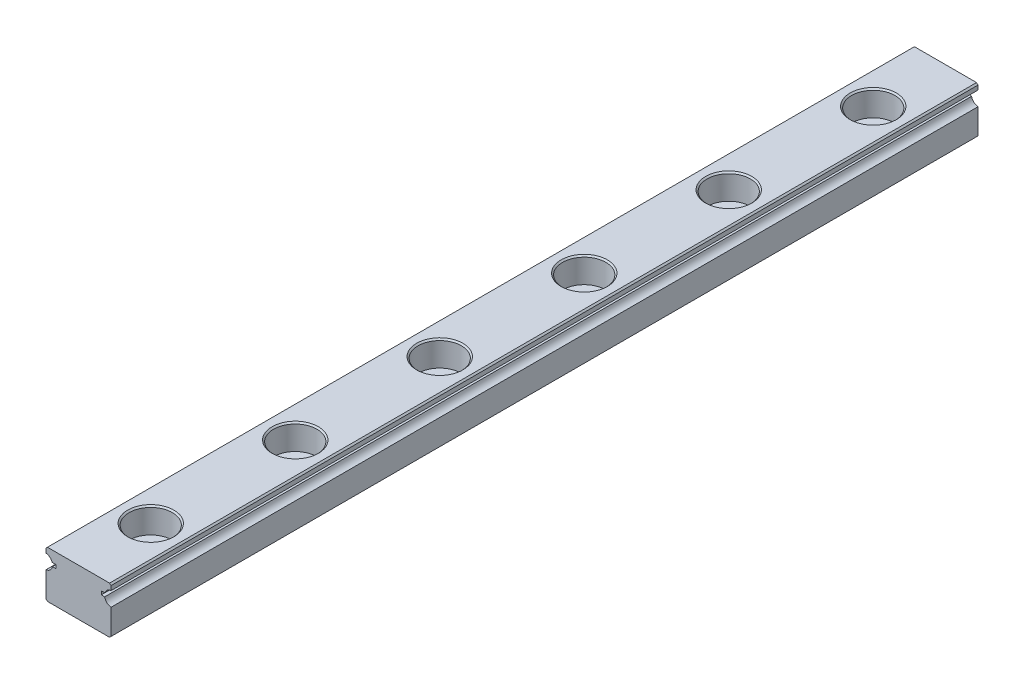
from build123d import *

# Parameters (mm, degrees)
EXTRUDE1_DEPTH             = 120
EXTRUDE2_REACH             = 122.26
SKETCH2_R                  = 1.75
SKETCH_R                   = 3
SKETCH_R_2                 = 1.75
EXTRUDE4_DEPTH             = 3.5
CHAMFER1_SIZE              = 0.2
LPATTERN1_COUNT            = 6
LPATTERN1_PITCH            = 20
CHAMFER1_OF_LPATTERN1_SIZE = 0.2


with BuildPart() as part:
    # Sketch1 → Extrude1 (new body)
    with BuildSketch(Plane.XY):
        with BuildLine():
            Line((-4.3, -3.25), (4.3, -3.25))
            Line((4.3, -3.25), (4.5, -3.05))
            Line((4.5, -3.05), (4.5, 0.455012563))
            ThreePointArc((4.5, 0.455012563), (3.924845827, 0.712323349), (3.617735397, 1.2625))
            Line((3.617735397, 1.2625), (3.15008224, 1.2625))
            Line((3.15008224, 1.2625), (3.15008224, 1.7625))
            Line((3.15008224, 1.7625), (3.65008224, 1.7625))
            ThreePointArc((3.65008224, 1.7625), (3.973877727, 2.229724887), (4.5, 2.444987437))
            Line((4.5, 2.444987437), (4.5, 3.05))
            Line((4.5, 3.05), (4.3, 3.25))
            Line((4.3, 3.25), (-4.3, 3.25))
            Line((-4.3, 3.25), (-4.5, 3.05))
            Line((-4.5, 3.05), (-4.5, 2.444987437))
            ThreePointArc((-4.5, 2.444987437), (-3.973877727, 2.229724887), (-3.65008224, 1.7625))
            Line((-3.65008224, 1.7625), (-3.15008224, 1.7625))
            Line((-3.15008224, 1.7625), (-3.15008224, 1.2625))
            Line((-3.15008224, 1.2625), (-3.617735397, 1.2625))
            ThreePointArc((-3.617735397, 1.2625), (-3.924845827, 0.712323349), (-4.5, 0.455012563))
            Line((-4.5, 0.455012563), (-4.5, -3.05))
            Line((-4.5, -3.05), (-4.3, -3.25))
        make_face()
    extrude(amount=EXTRUDE1_DEPTH)

    # Sketch2 → Extrude2 (cut, up to next)
    with BuildSketch(Plane(origin=(0, 3.25, 0), x_dir=(1, 0, 0), z_dir=(0, 1, 0)), mode=Mode.PRIVATE) as extrude2_sk1:
        with Locations((0, -10)):
            Circle(SKETCH2_R)
    extrude2_tool1 = extrude(extrude2_sk1.sketch, amount=-EXTRUDE2_REACH, mode=Mode.PRIVATE) & part.part
    extrude2 = extrude2_tool1.solids().sort_by_distance((0, 3.25, 10))[0]
    add(extrude2, mode=Mode.SUBTRACT)

    # Sketch → Extrude4 (cut)
    with BuildSketch(Plane(origin=(0, 3.25, 0), x_dir=(1, 0, 0), z_dir=(0, 1, 0))):
        with Locations((0, -10)):
            Circle(SKETCH_R)
        with Locations((0, -10)):
            Circle(SKETCH_R_2, mode=Mode.SUBTRACT)
    extrude4 = extrude(amount=-EXTRUDE4_DEPTH, mode=Mode.SUBTRACT)

    # Chamfer1
    chamfer1_edges = [part.edges().sort_by_distance(p)[0] for p in [
        (-1.75, -3.25, 10),
        (-3, 3.25, 10),
    ]]
    chamfer(chamfer1_edges, length=CHAMFER1_SIZE)

    # LPattern1: Extrude2, Extrude4 ×6
    with Locations(*[(0, 0, i * LPATTERN1_PITCH) for i in range(1, LPATTERN1_COUNT)]):
        add(extrude2, mode=Mode.SUBTRACT)
        add(extrude4, mode=Mode.SUBTRACT)

    # Chamfer1 of LPattern1
    chamfer1_of_lpattern1_edges = [part.edges().sort_by_distance(p)[0] for p in [
        (-1.75, -3.25, 30),
        (-3, 3.25, 30),
        (-1.75, -3.25, 50),
        (-3, 3.25, 50),
        (-1.75, -3.25, 70),
        (-3, 3.25, 70),
        (-1.75, -3.25, 90),
        (-3, 3.25, 90),
        (-1.75, -3.25, 110),
        (-3, 3.25, 110),
    ]]
    chamfer(chamfer1_of_lpattern1_edges, length=CHAMFER1_OF_LPATTERN1_SIZE)


solid = part.part
